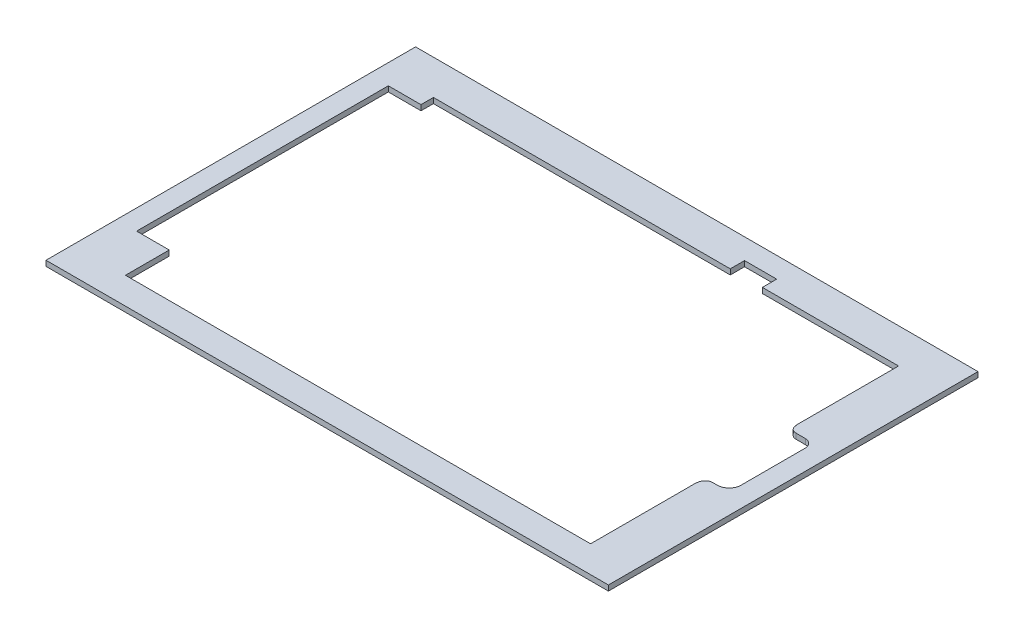
from build123d import *

# Parameters (mm, degrees)
SKETCH1_W           = 105
SKETCH1_H           = 69
BOSS_EXTRUDE1_DEPTH = 5
SKETCH2_W           = 86.836
SKETCH2_H           = 57.499
CUT_EXTRUDE1_DEPTH  = 81.210380614
CUT_EXTRUDE2_DEPTH  = 1
SKETCH4_W           = 5
SKETCH4_H           = 2.165
SKETCH4_H_2         = 0.335
CUT_EXTRUDE3_DEPTH  = 1
CUT_EXTRUDE4_DEPTH  = 81.210380614
SKETCH6_W           = 105
SKETCH6_H           = 69
CUT_EXTRUDE5_DEPTH  = 4


with BuildPart() as part:
    # Sketch1 → Boss-Extrude1 (new body)
    with BuildSketch(Plane(origin=(0, 0, 0), x_dir=(1, 0, 0), z_dir=(0, 1, 0))):
        Rectangle(SKETCH1_W, SKETCH1_H)
    extrude(amount=BOSS_EXTRUDE1_DEPTH)

    # Sketch2 → Cut-Extrude1 (cut, through all)
    with BuildSketch(Plane(origin=(17.072113262, 0, 5.103361153), x_dir=(-1, 0, 0), z_dir=(0, -1, 0))):
        with Locations((16.310113262, 4.341361153)):
            Rectangle(SKETCH2_W, SKETCH2_H)
    extrude(amount=-CUT_EXTRUDE1_DEPTH, mode=Mode.SUBTRACT)

    # Sketch3 → Cut-Extrude2 (cut)
    with BuildSketch(Plane(origin=(17.072113262, 0, 5.103361153), x_dir=(-1, 0, 0), z_dir=(0, -1, 0))):
        Polygon((59.822113262, 30.765861153), (54.524773562, 30.765861153), (54.524773562, -16.234138847), (59.822113262, -16.234138847), (65.822113262, -16.234138847), (65.822113262, 30.765861153), align=None)
    extrude(amount=-CUT_EXTRUDE2_DEPTH, mode=Mode.SUBTRACT)

    # Sketch4 → Cut-Extrude3 (cut)
    with BuildSketch(Plane(origin=(17.072113262, 0, 5.103361153), x_dir=(-1, 0, 0), z_dir=(0, -1, 0))):
        Polygon((-1.187888405, 35.255861153), (3.812111595, 35.255861153), (3.812111595, 33.090861153), (4.312111595, 33.090861153), (4.312111595, 35.755861153), (-1.687888405, 35.755861153), (-1.687888405, 33.090861153), (-1.187888405, 33.090861153), align=None)
        with Locations((1.312111595, 34.173361153)):
            Rectangle(SKETCH4_W, SKETCH4_H)
        Polygon((4.312111595, 33.090861153), (3.812111595, 33.090861153), (3.812111595, 32.755861153), (-1.187888405, 32.755861153), (-1.187888405, 33.090861153), (-1.687888405, 33.090861153), (-1.687888405, 32.255861153), (4.312111595, 32.255861153), align=None)
        with Locations((1.312111595, 32.923361153)):
            Rectangle(SKETCH4_W, SKETCH4_H_2)
    extrude(amount=-CUT_EXTRUDE3_DEPTH, mode=Mode.SUBTRACT)

    # Sketch5 → Cut-Extrude4 (cut, through all)
    with BuildSketch(Plane(origin=(17.072113262, 0, 5.103361153), x_dir=(-1, 0, 0), z_dir=(0, -1, 0))):
        with BuildLine():
            Line((-31.677886738, -0.896638847), (-31.677886738, 11.103361153))
            ThreePointArc((-31.677886738, 11.103361153), (-31.220399504, 12.207833039), (-30.115927617, 12.665320274))
            Line((-30.115927617, 12.665320274), (-28.350143546, 12.665320274))
            ThreePointArc((-28.350143546, 12.665320274), (-27.521232808, 13.008666344), (-27.177886738, 13.837577082))
            Line((-27.177886738, 13.837577082), (-18.865935491, 13.837577082))
            Line((-18.865935491, 13.837577082), (-18.865935491, -4.56597095))
            Line((-18.865935491, -4.56597095), (-27.177886738, -4.56597095))
            ThreePointArc((-27.177886738, -4.56597095), (-27.60841615, -3.526581006), (-28.647806094, -3.096051594))
            Line((-28.647806094, -3.096051594), (-29.478473991, -3.096051594))
            ThreePointArc((-29.478473991, -3.096051594), (-31.033693659, -2.451858515), (-31.677886738, -0.896638847))
        make_face()
    extrude(amount=-CUT_EXTRUDE4_DEPTH, mode=Mode.SUBTRACT)

    # Sketch6 → Cut-Extrude5 (cut)
    with BuildSketch(Plane(origin=(0, 5, 0), x_dir=(1, 0, 0), z_dir=(0, 1, 0))):
        Rectangle(SKETCH6_W, SKETCH6_H)
    extrude(amount=-CUT_EXTRUDE5_DEPTH, mode=Mode.SUBTRACT)


solid = part.part
